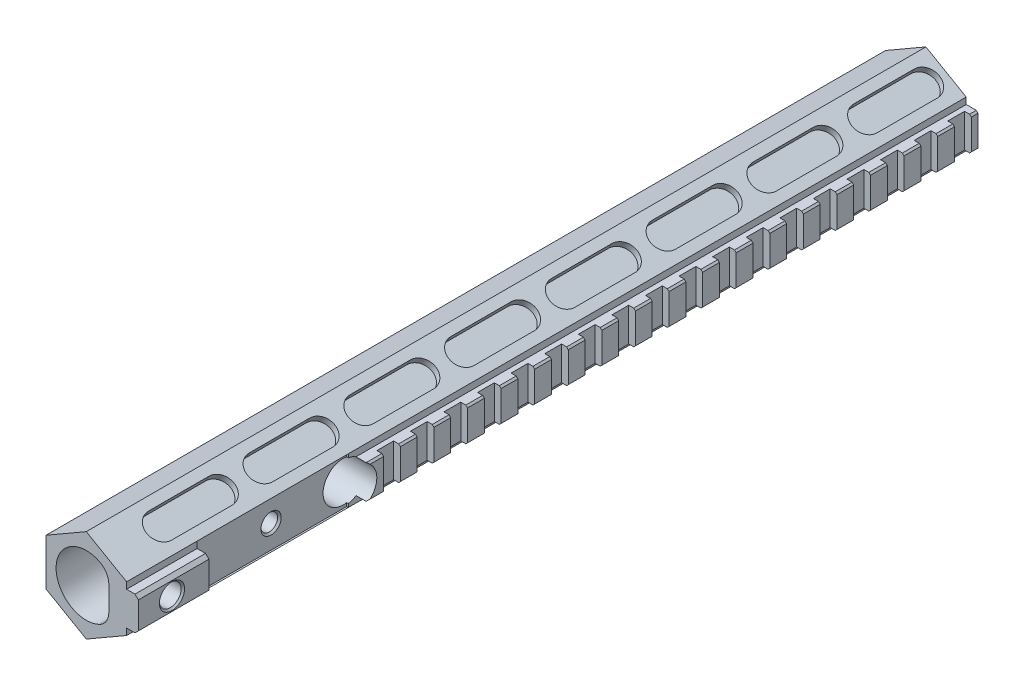
from build123d import *

# Parameters (mm, degrees)
EXTRUDE_1_DEPTH              = 250
CUT_EXTRUDE_1_DEPTH          = 2
HOLE_WIZARD_M8_1_D           = 6.8
HOLE_WIZARD_M8_1_DEPTH       = 25
HOLE_WIZARD_M8_1_TIP         = 2.042926105
HOLE_WIZARD_M6_2_D           = 5
HOLE_WIZARD_M6_2_DEPTH       = 15
HOLE_WIZARD_M6_2_TIP         = 1.502151548
CUT_EXTRUDE_2_DEPTH          = 21
SKETCH_39_W                  = 3.5
SKETCH_39_H                  = 10
EXTRUDE_6_DEPTH              = 250
SKETCH_40_W                  = 45
SKETCH_40_H                  = 13.85640646
CUT_EXTRUDE_3_DEPTH          = 4
SKETCH_41_W                  = 5
SKETCH_41_H                  = 10
CUT_EXTRUDE_4_DEPTH          = 2
HOLE_WIZARD_1_D              = 6.5
HOLE_WIZARD_1_DEPTH          = 8.8
HOLE_WIZARD_M6_3_D           = 5
HOLE_WIZARD_M6_3_DEPTH       = 15
HOLE_WIZARD_M6_3_CSINK_D     = 6.05
HOLE_WIZARD_M6_3_CSINK_ANGLE = 90
HOLE_WIZARD_M6_3_TIP         = 1.502151548
HOLE_WIZARD_2_D              = 6.5
HOLE_WIZARD_2_CBORE_D        = 12
HOLE_WIZARD_2_CBORE_DEPTH    = 16
CHAMFER_5_SIZE               = 1
CHAMFER_6_SIZE               = 0.5
CHAMFER_7_SIZE               = 0.5


with BuildPart() as part:
    # 草图1 → 凸台-拉伸1 (new body)
    with BuildSketch(Plane.XY):
        Polygon((0, -13.856406461), (12, -6.92820323), (12, 6.92820323), (0, 13.856406461), (-12, 6.92820323), (-12, -6.92820323), align=None)
    extrude(amount=-EXTRUDE_1_DEPTH)

    # 草图8 → 切除-拉伸1 (cut)
    with BuildSketch(Plane(origin=(6, -10.392304845, 0), x_dir=(0.8660254037844386, 0.5000000000000002, 0), z_dir=(0.5000000000000002, -0.8660254037844386, 0))):
        with BuildLine():
            Line((3.97179677, -16), (3.97179677, -34))
            ThreePointArc((3.97179677, -34), (-0.02820323, -38), (-4.02820323, -34))
            Line((-4.02820323, -34), (-4.02820323, -16))
            ThreePointArc((-4.02820323, -16), (-0.02820323, -12), (3.97179677, -16))
        make_face()
        with BuildLine():
            Line((3.97179677, -46), (3.97179677, -64))
            ThreePointArc((3.97179677, -64), (-0.02820323, -68), (-4.02820323, -64))
            Line((-4.02820323, -64), (-4.02820323, -46))
            ThreePointArc((-4.02820323, -46), (-0.02820323, -42), (3.97179677, -46))
        make_face()
        with BuildLine():
            Line((3.97179677, -76), (3.97179677, -94))
            ThreePointArc((3.97179677, -94), (-0.02820323, -98), (-4.02820323, -94))
            Line((-4.02820323, -94), (-4.02820323, -76))
            ThreePointArc((-4.02820323, -76), (-0.02820323, -72), (3.97179677, -76))
        make_face()
        with BuildLine():
            Line((3.97179677, -106), (3.97179677, -124))
            ThreePointArc((3.97179677, -124), (-0.02820323, -128), (-4.02820323, -124))
            Line((-4.02820323, -124), (-4.02820323, -106))
            ThreePointArc((-4.02820323, -106), (-0.02820323, -102), (3.97179677, -106))
        make_face()
        with BuildLine():
            Line((3.97179677, -136), (3.97179677, -154))
            ThreePointArc((3.97179677, -154), (-0.02820323, -158), (-4.02820323, -154))
            Line((-4.02820323, -154), (-4.02820323, -136))
            ThreePointArc((-4.02820323, -136), (-0.02820323, -132), (3.97179677, -136))
        make_face()
        with BuildLine():
            Line((3.97179677, -166), (3.97179677, -184))
            ThreePointArc((3.97179677, -184), (-0.02820323, -188), (-4.02820323, -184))
            Line((-4.02820323, -184), (-4.02820323, -166))
            ThreePointArc((-4.02820323, -166), (-0.02820323, -162), (3.97179677, -166))
        make_face()
        with BuildLine():
            Line((3.97179677, -196), (3.97179677, -214))
            ThreePointArc((3.97179677, -214), (-0.02820323, -218), (-4.02820323, -214))
            Line((-4.02820323, -214), (-4.02820323, -196))
            ThreePointArc((-4.02820323, -196), (-0.02820323, -192), (3.97179677, -196))
        make_face()
        with BuildLine():
            Line((3.97179677, -226), (3.97179677, -244))
            ThreePointArc((3.97179677, -244), (-0.02820323, -248), (-4.02820323, -244))
            Line((-4.02820323, -244), (-4.02820323, -226))
            ThreePointArc((-4.02820323, -226), (-0.02820323, -222), (3.97179677, -226))
        make_face()
    cut_extrude_1 = extrude(amount=-CUT_EXTRUDE_1_DEPTH, mode=Mode.SUBTRACT)

    # 镜向2: 切除-拉伸1 across plane
    add(cut_extrude_1.mirror(Plane.ZX), mode=Mode.SUBTRACT)

    # M8 螺纹孔1
    with Locations(Plane(origin=(0, 0, -250), x_dir=(-1, 0, 0), z_dir=(0, 0, -1))):
        with Locations((0, 0)):
            Hole(HOLE_WIZARD_M8_1_D / 2, depth=HOLE_WIZARD_M8_1_DEPTH)
            with Locations((0, 0, -(HOLE_WIZARD_M8_1_DEPTH + HOLE_WIZARD_M8_1_TIP / 2))):  # 118° drill point
                Cone(0, HOLE_WIZARD_M8_1_D / 2, HOLE_WIZARD_M8_1_TIP, mode=Mode.SUBTRACT)

    # M6 螺纹孔2
    with Locations(Plane.ZY.offset(12)):
        with Locations((-170, 0)):
            Hole(HOLE_WIZARD_M6_2_D / 2, depth=HOLE_WIZARD_M6_2_DEPTH)
            with Locations((0, 0, -(HOLE_WIZARD_M6_2_DEPTH + HOLE_WIZARD_M6_2_TIP / 2))):  # 118° drill point
                Cone(0, HOLE_WIZARD_M6_2_D / 2, HOLE_WIZARD_M6_2_TIP, mode=Mode.SUBTRACT)

    # 草图32 → 切除-拉伸2 (cut)
    with BuildSketch(Plane.XY):
        with BuildLine():
            Line((6.7, 3.620773398), (6.7, -3.620773398))
            ThreePointArc((6.7, -3.620773398), (5.920485754, -6.301724722), (3.825, -8.146740146))
            ThreePointArc((3.825, -8.146740146), (-9, 0), (3.825, 8.146740146))
            ThreePointArc((3.825, 8.146740146), (5.920485754, 6.301724722), (6.7, 3.620773398))
        make_face()
    extrude(amount=-CUT_EXTRUDE_2_DEPTH, mode=Mode.SUBTRACT)

    # 草图39 → 凸台-拉伸6 (add)
    with BuildSketch(Plane.XY):
        with Locations((13.75, 0)):
            Rectangle(SKETCH_39_W, SKETCH_39_H)
    extrude(amount=-EXTRUDE_6_DEPTH)

    # 草图40 → 切除-拉伸3 (cut)
    with BuildSketch(Plane(origin=(15.5, 0, 0), x_dir=(0, 0, -1), z_dir=(1, 0, 0))):
        with Locations((43.5, 0)):
            Rectangle(SKETCH_40_W, SKETCH_40_H)
    extrude(amount=-CUT_EXTRUDE_3_DEPTH, mode=Mode.SUBTRACT)

    # 草图41 → 切除-拉伸4 (cut)
    with BuildSketch(Plane(origin=(15.5, 0, 0), x_dir=(0, 0, -1), z_dir=(1, 0, 0))):
        with Locations((245.5, 0)):
            Rectangle(SKETCH_41_W, SKETCH_41_H)
        with Locations((225.5, 0)):
            Rectangle(SKETCH_41_W, SKETCH_41_H)
        with Locations((235.5, 0)):
            Rectangle(SKETCH_41_W, SKETCH_41_H)
        with Locations((215.5, 0)):
            Rectangle(SKETCH_41_W, SKETCH_41_H)
        with Locations((205.5, 0)):
            Rectangle(SKETCH_41_W, SKETCH_41_H)
        with Locations((195.5, 0)):
            Rectangle(SKETCH_41_W, SKETCH_41_H)
        with Locations((185.5, 0)):
            Rectangle(SKETCH_41_W, SKETCH_41_H)
        with Locations((175.5, 0)):
            Rectangle(SKETCH_41_W, SKETCH_41_H)
        with Locations((165.5, 0)):
            Rectangle(SKETCH_41_W, SKETCH_41_H)
        with Locations((155.5, 0)):
            Rectangle(SKETCH_41_W, SKETCH_41_H)
        with Locations((145.5, 0)):
            Rectangle(SKETCH_41_W, SKETCH_41_H)
        with Locations((135.5, 0)):
            Rectangle(SKETCH_41_W, SKETCH_41_H)
        with Locations((125.5, 0)):
            Rectangle(SKETCH_41_W, SKETCH_41_H)
        with Locations((115.5, 0)):
            Rectangle(SKETCH_41_W, SKETCH_41_H)
        with Locations((105.5, 0)):
            Rectangle(SKETCH_41_W, SKETCH_41_H)
        with Locations((95.5, 0)):
            Rectangle(SKETCH_41_W, SKETCH_41_H)
        with Locations((85.5, 0)):
            Rectangle(SKETCH_41_W, SKETCH_41_H)
        with Locations((75.5, 0)):
            Rectangle(SKETCH_41_W, SKETCH_41_H)
    extrude(amount=-CUT_EXTRUDE_4_DEPTH, mode=Mode.SUBTRACT)

    # 孔1
    with Locations(Plane(origin=(15.5, 0, 0), x_dir=(0, 0, -1), z_dir=(1, 0, 0))):
        with Locations((10, 0)):
            Hole(HOLE_WIZARD_1_D / 2, depth=HOLE_WIZARD_1_DEPTH)

    # M6 螺纹孔3
    with Locations(Plane(origin=(11.5, 0, 0), x_dir=(0, 0, -1), z_dir=(1, 0, 0))):
        with Locations((43.5, 0)):
            CounterSinkHole(HOLE_WIZARD_M6_3_D / 2, HOLE_WIZARD_M6_3_CSINK_D / 2, depth=HOLE_WIZARD_M6_3_DEPTH, counter_sink_angle=HOLE_WIZARD_M6_3_CSINK_ANGLE)
            with Locations((0, 0, -(HOLE_WIZARD_M6_3_DEPTH + HOLE_WIZARD_M6_3_TIP / 2))):  # 118° drill point
                Cone(0, HOLE_WIZARD_M6_3_D / 2, HOLE_WIZARD_M6_3_TIP, mode=Mode.SUBTRACT)

    # 孔2 (through all)
    with Locations(Plane(origin=(15.5, 0, 0), x_dir=(0, 0, -1), z_dir=(1, 0, 0))):
        with Locations((65, 0)):
            CounterBoreHole(HOLE_WIZARD_2_D / 2, HOLE_WIZARD_2_CBORE_D / 2, HOLE_WIZARD_2_CBORE_DEPTH)

    # 倒角5
    chamfer_5_edges = [part.edges().sort_by_distance(p)[0] for p in [
        (15.5, -5, -10.5),
        (15.5, 5, -10.5),
    ]]
    chamfer(chamfer_5_edges, length=CHAMFER_5_SIZE)

    # 倒角6
    chamfer_6_edges = [part.edges().sort_by_distance(p)[0] for p in [
        (15.5, 0, -13.25),
    ]]
    chamfer(chamfer_6_edges, length=CHAMFER_6_SIZE)

    # 倒角7
    chamfer_7_edges = [part.edges().sort_by_distance(p)[0] for p in [
        (15.5, 5, -249),
        (15.5, -5, -249),
        (15.5, -5, -240.5),
        (15.5, -5, -230.5),
        (15.5, -5, -220.5),
        (15.5, -5, -210.5),
        (15.5, -5, -200.5),
        (15.5, -5, -190.5),
        (15.5, -5, -180.5),
        (15.5, -5, -170.5),
        (15.5, -5, -160.5),
        (15.5, -5, -150.5),
        (15.5, -5, -140.5),
        (15.5, -5, -130.5),
        (15.5, -5, -120.5),
        (15.5, -5, -110.5),
        (15.5, -5, -100.5),
        (15.5, -5, -90.5),
        (15.5, -5, -80.5),
        (15.5, -5, -70.658312395),
        (15.5, 5, -240.5),
        (15.5, 5, -230.5),
        (15.5, 5, -220.5),
        (15.5, 5, -210.5),
        (15.5, 5, -200.5),
        (15.5, 5, -190.5),
        (15.5, 5, -180.5),
        (15.5, 5, -170.5),
        (15.5, 5, -160.5),
        (15.5, 5, -150.5),
        (15.5, 5, -140.5),
        (15.5, 5, -130.5),
        (15.5, 5, -120.5),
        (15.5, 5, -110.5),
        (15.5, 5, -100.5),
        (15.5, 5, -90.5),
        (15.5, 5, -80.5),
        (15.5, 5, -70.658312395),
    ]]
    chamfer(chamfer_7_edges, length=CHAMFER_7_SIZE)


solid = part.part
